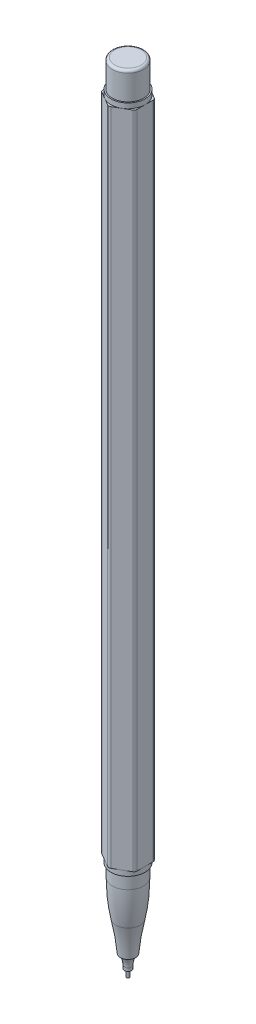
from build123d import *

# Parameters (mm, degrees)
RESSALTO_EXTRUS_O1_DEPTH = 130
ESBO_O2_R                = 3.35
RESSALTO_EXTRUS_O2_DEPTH = 1
ESBO_O3_R                = 3.1
RESSALTO_EXTRUS_O3_DEPTH = 5.4
FILETE1_R                = 0.5
RESSALTO_EXTRUS_O4_START = 1
ESBO_O4_R                = 3.35
RESSALTO_EXTRUS_O4_DEPTH = 1


with BuildPart() as part:
    # Esboço1 → Ressalto-extrusão1 (new body)
    with BuildSketch(Plane(origin=(0, 0, 0), x_dir=(1, 0, 0), z_dir=(0, 1, 0))):
        with BuildLine():
            Line((0.3, -3.695041723), (3.05, -2.107328483))
            ThreePointArc((3.05, -2.107328483), (3.269615242, -1.88771324), (3.35, -1.58771324))
            Line((3.35, -1.58771324), (3.35, 1.58771324))
            ThreePointArc((3.35, 1.58771324), (3.269615242, 1.88771324), (3.05, 2.107328483))
            Line((3.05, 2.107328483), (0.3, 3.695041723))
            ThreePointArc((0.3, 3.695041723), (0, 3.775426481), (-0.3, 3.695041723))
            Line((-0.3, 3.695041723), (-3.05, 2.107328483))
            ThreePointArc((-3.05, 2.107328483), (-3.269615242, 1.88771324), (-3.35, 1.58771324))
            Line((-3.35, 1.58771324), (-3.35, -1.58771324))
            ThreePointArc((-3.35, -1.58771324), (-3.269615242, -1.88771324), (-3.05, -2.107328483))
            Line((-3.05, -2.107328483), (-0.3, -3.695041723))
            ThreePointArc((-0.3, -3.695041723), (0, -3.775426481), (0.3, -3.695041723))
        make_face()
    extrude(amount=RESSALTO_EXTRUS_O1_DEPTH)

    # Esboço2 → Ressalto-extrusão2 (add)
    with BuildSketch(Plane(origin=(0, 130, 0), x_dir=(1, 0, 0), z_dir=(0, 1, 0))):
        with Locations(Location((0, 0, 0), (0, 0, 60))):
            Circle(ESBO_O2_R)
    extrude(amount=RESSALTO_EXTRUS_O2_DEPTH)

    # Esboço3 → Ressalto-extrusão3 (add)
    with BuildSketch(Plane(origin=(0, 131, 0), x_dir=(1, 0, 0), z_dir=(0, 1, 0))):
        with Locations(Location((0, 0, 0), (0, 0, 90))):
            Circle(ESBO_O3_R)
    extrude(amount=RESSALTO_EXTRUS_O3_DEPTH)

    # Filete1
    filete1_edges = [part.edges().sort_by_distance(p)[0] for p in [
        (0, 136.4, 3.1),
    ]]
    fillet(filete1_edges, radius=FILETE1_R)

    # Esboço4 → Ressalto-extrusão4 (add)
    with BuildSketch(Plane.XZ.offset(RESSALTO_EXTRUS_O4_START)):
        with Locations(Location((0, 0, 0), (0, 0, 300))):
            Circle(ESBO_O4_R)
    extrude(amount=-RESSALTO_EXTRUS_O4_DEPTH)

    # Esboço5 → Revolução1 (revolve)
    with BuildSketch(Plane.XY, mode=Mode.PRIVATE) as revolu_o1_sk:
        with BuildLine():
            Line((3.05, -1), (3.05, -3.5))
            ThreePointArc((3.05, -3.5), (2.884182518, -7.015607207), (2.388202336, -10.5))
            ThreePointArc((2.388202336, -10.5), (1.838385418, -13.484350504), (1.5, -16.5))
            Line((1.5, -16.5), (1.2, -16.5))
            ThreePointArc((1.2, -16.5), (0.8415304, -17.4728826), (0.7, -18.5))
            Line((0.7, -18.5), (0.7, -19.1))
            Line((0.7, -19.1), (0.3, -19.1))
            Line((0.3, -19.1), (0.3, -20.5))
            Line((0.3, -20.5), (0, -20.5))
            Line((0, -20.5), (0, -1))
            Line((0, -1), (3.05, -1))
        make_face()
    revolve(revolu_o1_sk.sketch.rotate(Axis((0, -1, 0), (0, -1, 0)), 180), axis=Axis((0, -1, 0), (0, -1, 0)))


solid = part.part
